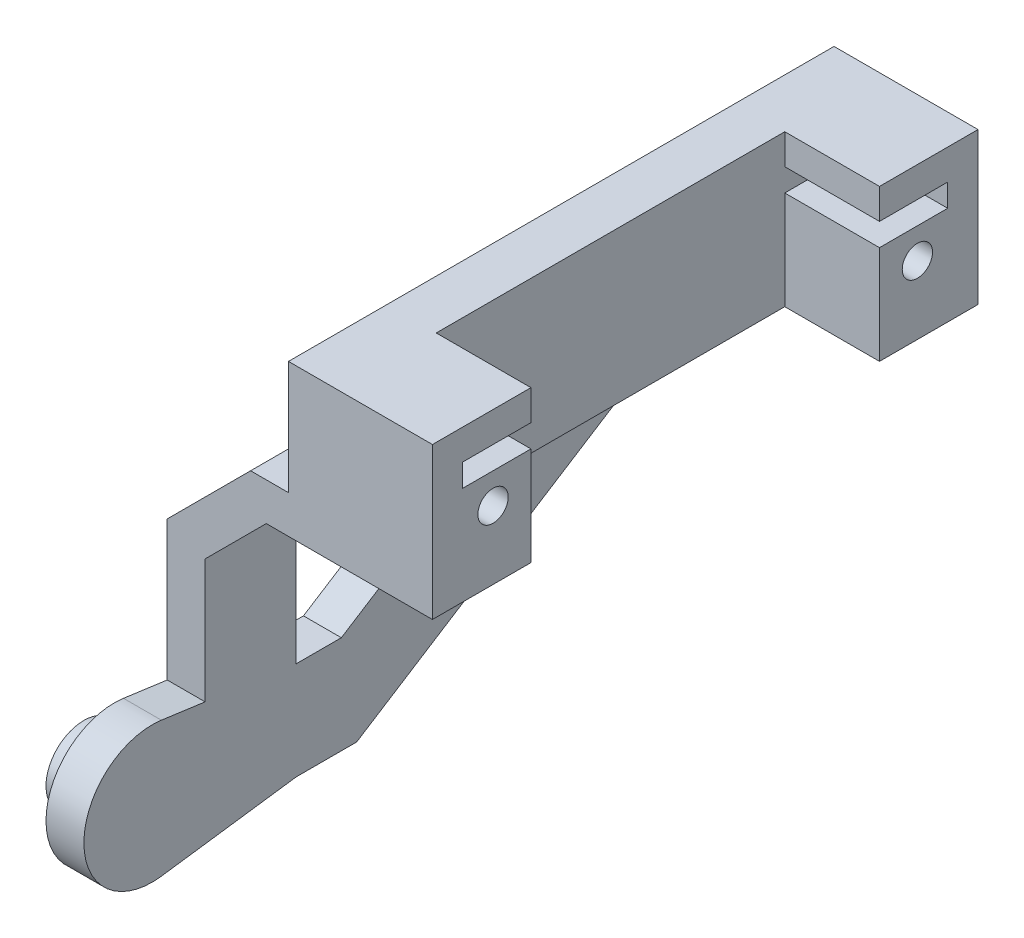
from build123d import *

# Parameters (mm, degrees)
EXTRUDE_1_DEPTH     = 18
CUT_EXTRUDE_1_REACH = 33.788
CUT_EXTRUDE_2_DEPTH = 6.25
SKETCH_4_R          = 1
CUT_EXTRUDE_3_DEPTH = 39.303882092
SKETCH_5_R          = 2
CUT_EXTRUDE_4_DEPTH = 2
EXTRUDE_3_DEPTH     = 2.5
EXTRUDE_START       = -2.5
SKETCH_6_3_R        = 2.5
EXTRUDE_4_DEPTH     = 2


with BuildPart() as part:
    # 草图1 → 凸台-拉伸1 (new, symmetric)
    with BuildSketch(Plane.XY):
        Polygon((0, 0), (0, 10), (-9.5, 10), (-9.5, 2.5), (-12, 2.5), (-17.5, -3), (-17.5, -19.5), (-15, -19.5), (-15, -4.035533906), (-10.964466094, 0), align=None)
    extrude(amount=EXTRUDE_1_DEPTH, both=True)

    # 草图2 → 切除-拉伸1 (cut, up to next)
    with BuildSketch(Plane.ZY.offset(17.5), mode=Mode.PRIVATE) as cut_extrude_1_sk1:
        Polygon((-1.5, -6.364922728), (-1.5, -4.035533906), (12, -4.035533906), (12, -13.035533906), (9.011266099, -13.035533906), align=None)
    cut_extrude_1_tool1 = extrude(cut_extrude_1_sk1.sketch, amount=-CUT_EXTRUDE_1_REACH, mode=Mode.PRIVATE) & part.part
    # 草图2 → 切除-拉伸1 (cut, up to next)
    with BuildSketch(Plane.ZY.offset(17.5), mode=Mode.PRIVATE) as cut_extrude_1_sk2:
        Polygon((-18, -3), (8, -19.5), (-18, -19.5), align=None)
    cut_extrude_1_tool2 = extrude(cut_extrude_1_sk2.sketch, amount=-CUT_EXTRUDE_1_REACH, mode=Mode.PRIVATE) & part.part
    add(cut_extrude_1_tool1.solids().sort_by_distance((-17.5, -7.612266, 6.566584))[0], mode=Mode.SUBTRACT)
    add(cut_extrude_1_tool2.solids().sort_by_distance((-17.5, -14, -9.333333))[0], mode=Mode.SUBTRACT)

    # 草图3 → 切除-拉伸2 (cut, symmetric)
    with BuildSketch(Plane(origin=(0, 8.894521129, 0.833176928), x_dir=(0, -1, 0), z_dir=(-1, 0, 0))):
        Polygon((2.394521129, 15.166823072), (2.394521129, 10.666823072), (8.894521129, 10.666823072), (8.894521129, -12.333176928), (2.394521129, -12.333176928), (2.394521129, -16.833176928), (0.894521129, -16.833176928), (0.894521129, -12.333176928), (-3.105478871, -12.333176928), (-3.105478871, 10.666823072), (0.894521129, 10.666823072), (0.894521129, 15.166823072), align=None)
    extrude(amount=CUT_EXTRUDE_2_DEPTH, both=True, mode=Mode.SUBTRACT)

    # 草图4 → 切除-拉伸3 (cut, through all)
    with BuildSketch(Plane(origin=(0, 8.894521129, 0.833176928), x_dir=(0, -1, 0), z_dir=(-1, 0, 0))):
        with Locations(Location((4.394521129, -14.833176928, 0), (0, 0, 180))):
            Circle(SKETCH_4_R)
        with Locations(Location((4.394521129, 13.166823072, 0), (0, 0, 180))):
            Circle(SKETCH_4_R)
    extrude(amount=CUT_EXTRUDE_3_DEPTH, mode=Mode.SUBTRACT)

    # 草图5 → 切除-拉伸4 (cut)
    with BuildSketch(Plane.ZY.offset(9.5)):
        with Locations(Location((14, 4.5, 0), (0, 0, 270))):
            Circle(SKETCH_5_R)
        with Locations(Location((-14, 4.5, 0), (0, 0, 270))):
            Circle(SKETCH_5_R)
    extrude(amount=-CUT_EXTRUDE_4_DEPTH, mode=Mode.SUBTRACT)

    # 草图6 → 凸台-拉伸3 (add)
    with BuildSketch(Plane(origin=(-15, 0, 0), x_dir=(0, 0, -1), z_dir=(1, 0, 0))):
        with BuildLine():
            ThreePointArc((-20.886363636, -11.809802124), (-26, -16.267766953), (-20.886363636, -20.725731782))
            Line((-20.886363636, -20.725731782), (-11.98162869, -19.5))
            Line((-11.98162869, -19.5), (-18, -19.5))
            Line((-18, -19.5), (-18, -12.207108463))
            Line((-18, -12.207108463), (-20.886363636, -11.809802124))
        make_face()
    extrude(amount=-EXTRUDE_3_DEPTH)

    # 草图6<3> → 凸台-拉伸4 (add)
    with BuildSketch(Plane(origin=(-15, 0, 0), x_dir=(0, 0, -1), z_dir=(1, 0, 0)).offset(EXTRUDE_START)):
        with Locations(Location((-21.5, -16.267766953, 0), (0, 0, 90))):
            Circle(SKETCH_6_3_R)
    extrude(amount=-EXTRUDE_4_DEPTH)


solid = part.part
